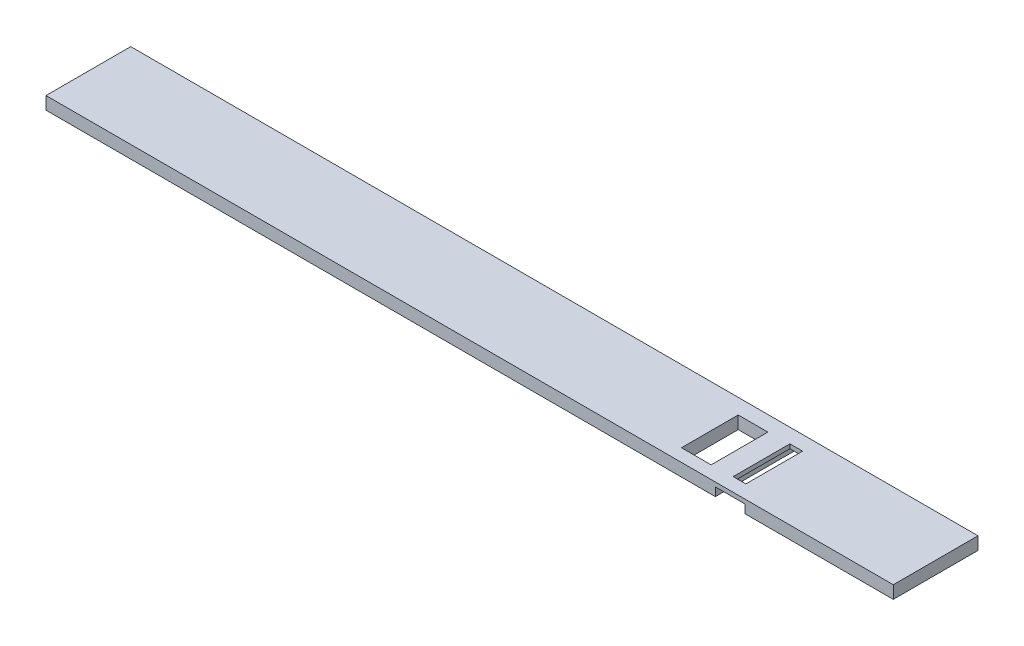
from build123d import *

# Parameters (mm, degrees)
SKETCH1_W           = 1000
SKETCH1_H           = 100
BOSS_EXTRUDE1_DEPTH = 15
SKETCH2_W           = 35
SKETCH2_H           = 67
CUT_EXTRUDE1_DEPTH  = 15
SKETCH4_W           = 35
SKETCH4_H           = 10
CUT_EXTRUDE2_DEPTH  = 100
SKETCH5_W           = 15
SKETCH5_H           = 67
CUT_EXTRUDE4_DEPTH  = 100


with BuildPart() as part:
    # Sketch1 → Boss-Extrude1 (new body)
    with BuildSketch(Plane(origin=(0, 0, 0), x_dir=(1, 0, 0), z_dir=(0, 1, 0))):
        with Locations((500, 50)):
            Rectangle(SKETCH1_W, SKETCH1_H)
    extrude(amount=BOSS_EXTRUDE1_DEPTH)

    # Sketch2 → Cut-Extrude1 (cut)
    with BuildSketch(Plane(origin=(0, 15, 0), x_dir=(1, 0, 0), z_dir=(0, 1, 0))):
        with Locations((752.5, 48.5)):
            Rectangle(SKETCH2_W, SKETCH2_H)
    extrude(amount=-CUT_EXTRUDE1_DEPTH, mode=Mode.SUBTRACT)

    # Sketch4 → Cut-Extrude2 (cut)
    with BuildSketch(Plane.XY):
        with Locations((807.5, 5)):
            Rectangle(SKETCH4_W, SKETCH4_H)
    extrude(amount=-CUT_EXTRUDE2_DEPTH, mode=Mode.SUBTRACT)

    # Sketch5 → Cut-Extrude4 (cut)
    with BuildSketch(Plane(origin=(0, 15, 0), x_dir=(1, 0, 0), z_dir=(0, 1, 0))):
        with Locations((802.5, 49.5)):
            Rectangle(SKETCH5_W, SKETCH5_H)
    extrude(amount=-CUT_EXTRUDE4_DEPTH, mode=Mode.SUBTRACT)


solid = part.part
